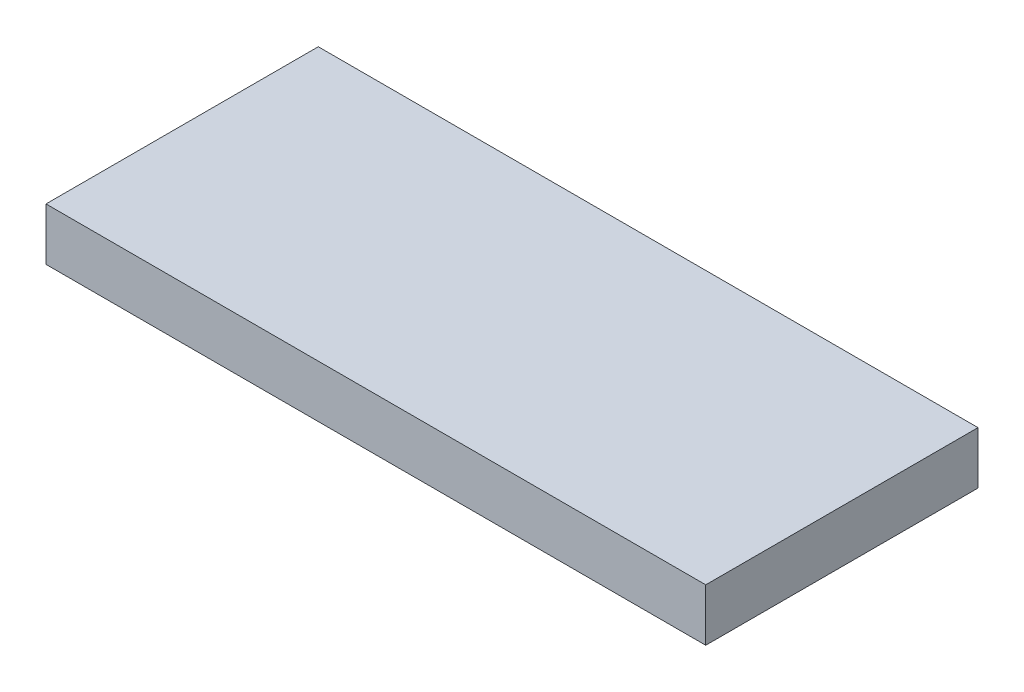
from build123d import *

# Parameters (mm, degrees)
SKETCH1_W           = 63
SKETCH1_H           = 26
BOSS_EXTRUDE1_DEPTH = 5


with BuildPart() as part:
    # Sketch1 → Boss-Extrude1 (new body)
    with BuildSketch(Plane(origin=(0, 0, 0), x_dir=(1, 0, 0), z_dir=(0, 1, 0))):
        with Locations((31.5, 13)):
            Rectangle(SKETCH1_W, SKETCH1_H)
    extrude(amount=BOSS_EXTRUDE1_DEPTH)


solid = part.part
